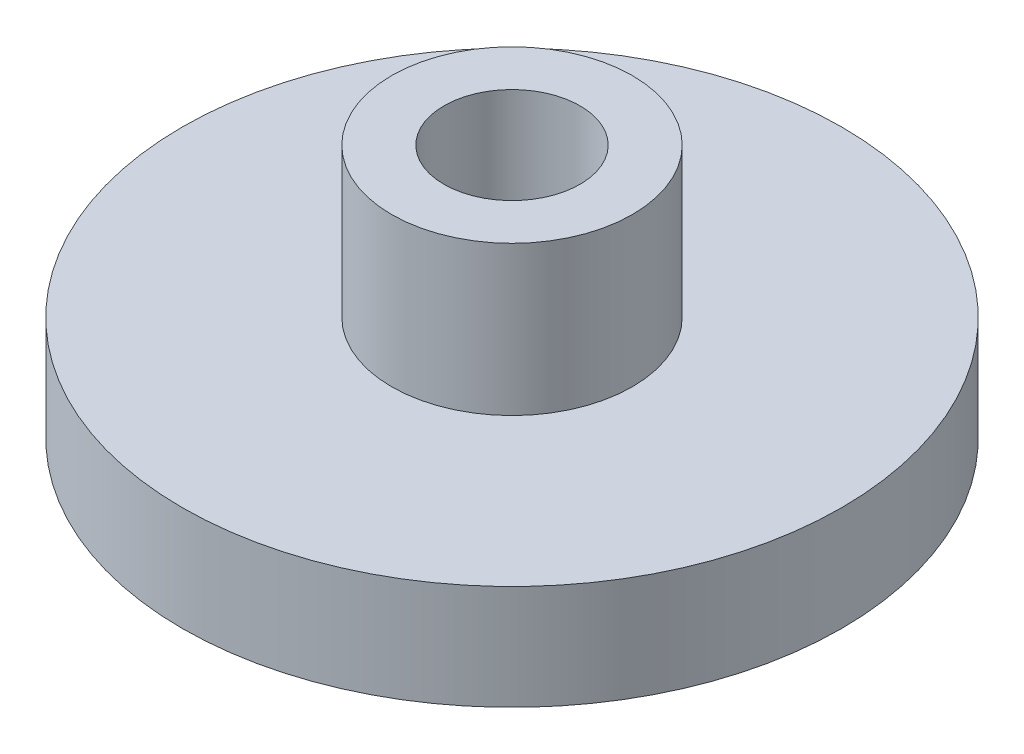
from build123d import *


with BuildPart() as part:
    # Sketch2 → Revolve1 (revolve)
    with BuildSketch(Plane.XY, mode=Mode.PRIVATE) as revolve1_sk:
        Polygon((8.255, 0), (8.255, 30.80004), (14.605, 30.80004), (14.605, 12.7), (40.005, 12.7), (40.005, 0), align=None)
    revolve(revolve1_sk.sketch.rotate(Axis((0, 47.915891606, 0), (0, -1, 0)), 90), axis=Axis((0, 47.915891606, 0), (0, -1, 0)))


solid = part.part
